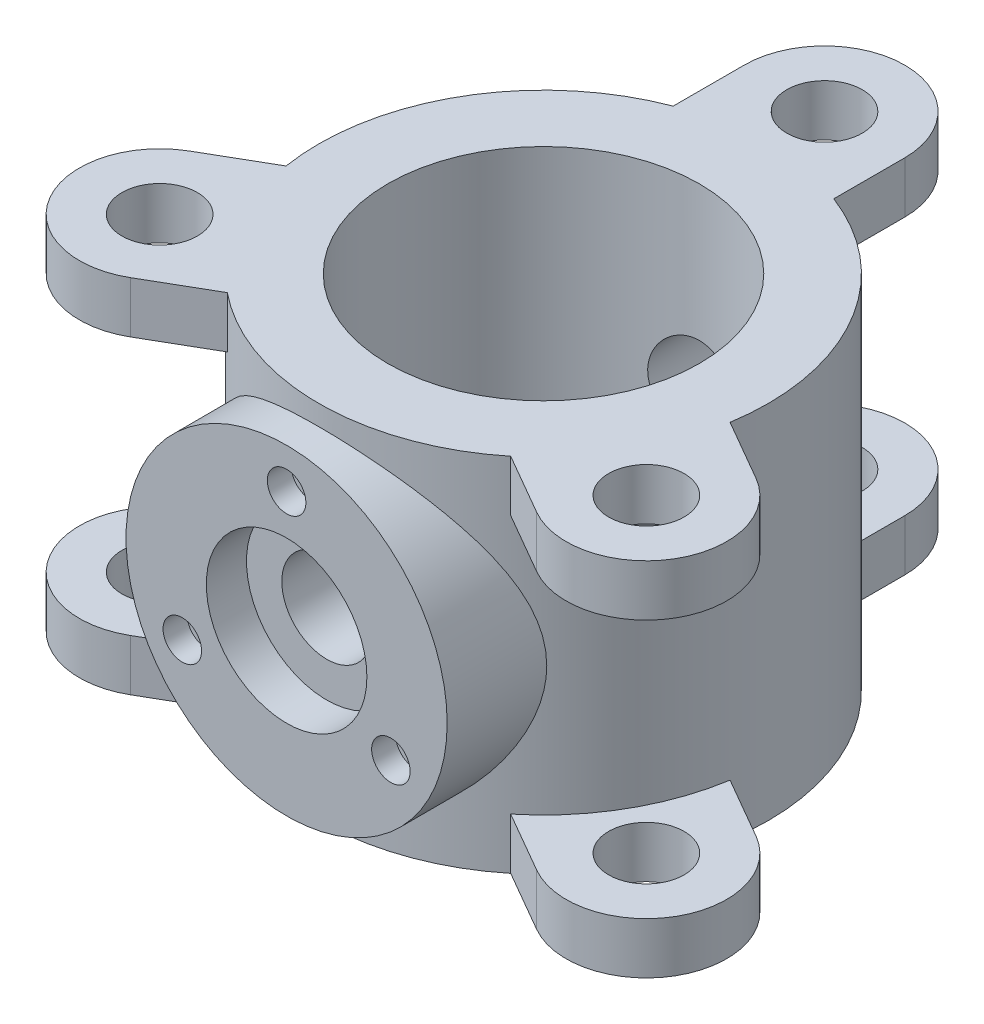
from build123d import *

# Parameters (mm, degrees)
SKETCH1_R               = 140
SKETCH1_R_2             = 97
BOSS_EXTRUDE1_DEPTH     = 112.5
SKETCH2_R               = 23.5
BOSS_EXTRUDE2_DEPTH     = 32
CIRPATTERN1_COUNT       = 3
MIRROR1_COPY_1_SKETCH_R = 23.5
MIRROR1_COPY_1_DEPTH    = 32
MIRROR1_COPY_2_SKETCH_R = 23.5
MIRROR1_COPY_2_DEPTH    = 32
MIRROR1_COPY_3_SKETCH_R = 23.5
MIRROR1_COPY_3_DEPTH    = 32
BOSS_EXTRUDE3_REACH     = 450.894
SKETCH3_R               = 100
SKETCH3_4_R             = 50
CUT_EXTRUDE1_DEPTH      = 25
SKETCH3_5_R             = 28
CUT_EXTRUDE2_DEPTH      = 449.893578244
SKETCH3_6_R             = 12
CUT_EXTRUDE3_DEPTH      = 15


with BuildPart() as part:
    # Sketch1 → Boss-Extrude1 (new, symmetric)
    with BuildSketch(Plane(origin=(0, 0, 0), x_dir=(1, 0, 0), z_dir=(0, 1, 0))):
        Circle(SKETCH1_R)
        Circle(SKETCH1_R_2, mode=Mode.SUBTRACT)
    extrude(amount=BOSS_EXTRUDE1_DEPTH, both=True)

    # Sketch2 → Boss-Extrude2 (add)
    with BuildSketch(Plane(origin=(0, 112.5, 0), x_dir=(1, 0, 0), z_dir=(0, 1, 0))):
        with BuildLine():
            Line((-50, 175), (-50, 130.766968306))
            ThreePointArc((-50, 130.766968306), (0, 140), (50, 130.766968306))
            Line((50, 130.766968306), (50, 175))
            ThreePointArc((50, 175), (0, 225), (-50, 175))
        make_face()
        with Locations((0, 175)):
            Circle(SKETCH2_R, mode=Mode.SUBTRACT)
    boss_extrude2 = extrude(amount=-BOSS_EXTRUDE2_DEPTH)

    # CirPattern1: Boss-Extrude2 ×3 about axis
    cirpattern1_axis = Axis((0, 112.5, 0), (0, -1, 0))
    for i in range(1, CIRPATTERN1_COUNT):
        add(boss_extrude2.rotate(cirpattern1_axis, i * 360 / CIRPATTERN1_COUNT))

    # Mirror1 copy 1 sketch → Mirror1 copy 1 (add)
    with BuildSketch(Plane(origin=(0, -112.5, 0), x_dir=(-0.4999999999999998, 0, 0.8660254037844387), z_dir=(0, -1, 0))):
        with BuildLine():
            Line((-50, -175), (-50, -130.766968306))
            ThreePointArc((-50, -130.766968306), (0, -140), (50, -130.766968306))
            Line((50, -130.766968306), (50, -175))
            ThreePointArc((50, -175), (0, -225), (-50, -175))
        make_face()
        with Locations((0, -175)):
            Circle(MIRROR1_COPY_1_SKETCH_R, mode=Mode.SUBTRACT)
    extrude(amount=-MIRROR1_COPY_1_DEPTH)

    # Mirror1 copy 2 sketch → Mirror1 copy 2 (add)
    with BuildSketch(Plane(origin=(0, -112.5, 0), x_dir=(-0.5000000000000004, 0, -0.8660254037844384), z_dir=(0, -1, 0))):
        with BuildLine():
            Line((-50, -175), (-50, -130.766968306))
            ThreePointArc((-50, -130.766968306), (0, -140), (50, -130.766968306))
            Line((50, -130.766968306), (50, -175))
            ThreePointArc((50, -175), (0, -225), (-50, -175))
        make_face()
        with Locations((0, -175)):
            Circle(MIRROR1_COPY_2_SKETCH_R, mode=Mode.SUBTRACT)
    extrude(amount=-MIRROR1_COPY_2_DEPTH)

    # Mirror1 copy 3 sketch → Mirror1 copy 3 (add)
    with BuildSketch(Plane.XZ.offset(112.5)):
        with BuildLine():
            Line((-50, -175), (-50, -130.766968306))
            ThreePointArc((-50, -130.766968306), (0, -140), (50, -130.766968306))
            Line((50, -130.766968306), (50, -175))
            ThreePointArc((50, -175), (0, -225), (-50, -175))
        make_face()
        with Locations((0, -175)):
            Circle(MIRROR1_COPY_3_SKETCH_R, mode=Mode.SUBTRACT)
    extrude(amount=-MIRROR1_COPY_3_DEPTH)

    # Sketch3 → Boss-Extrude3 (add, up to next)
    with BuildSketch(Plane.XY.offset(160), mode=Mode.PRIVATE) as boss_extrude3_sk1:
        Circle(SKETCH3_R)
    boss_extrude3_tool1 = extrude(boss_extrude3_sk1.sketch, amount=-BOSS_EXTRUDE3_REACH, mode=Mode.PRIVATE) - part.part
    add(boss_extrude3_tool1.solids().sort_by_distance((0, 0, 160))[0])

    # Sketch3<4> → Cut-Extrude1 (cut)
    with BuildSketch(Plane.XY.offset(160)):
        Circle(SKETCH3_4_R)
    extrude(amount=-CUT_EXTRUDE1_DEPTH, mode=Mode.SUBTRACT)

    # Sketch3<5> → Cut-Extrude2 (cut, through all)
    with BuildSketch(Plane.XY.offset(160)):
        Circle(SKETCH3_5_R)
    extrude(amount=-CUT_EXTRUDE2_DEPTH, mode=Mode.SUBTRACT)

    # Sketch3<6> → Cut-Extrude3 (cut)
    with BuildSketch(Plane.XY.offset(160)):
        with Locations((0, 75)):
            Circle(SKETCH3_6_R)
        with Locations((64.951905284, -37.5)):
            Circle(SKETCH3_6_R)
        with Locations((-64.951905284, -37.5)):
            Circle(SKETCH3_6_R)
    extrude(amount=-CUT_EXTRUDE3_DEPTH, mode=Mode.SUBTRACT)


solid = part.part
